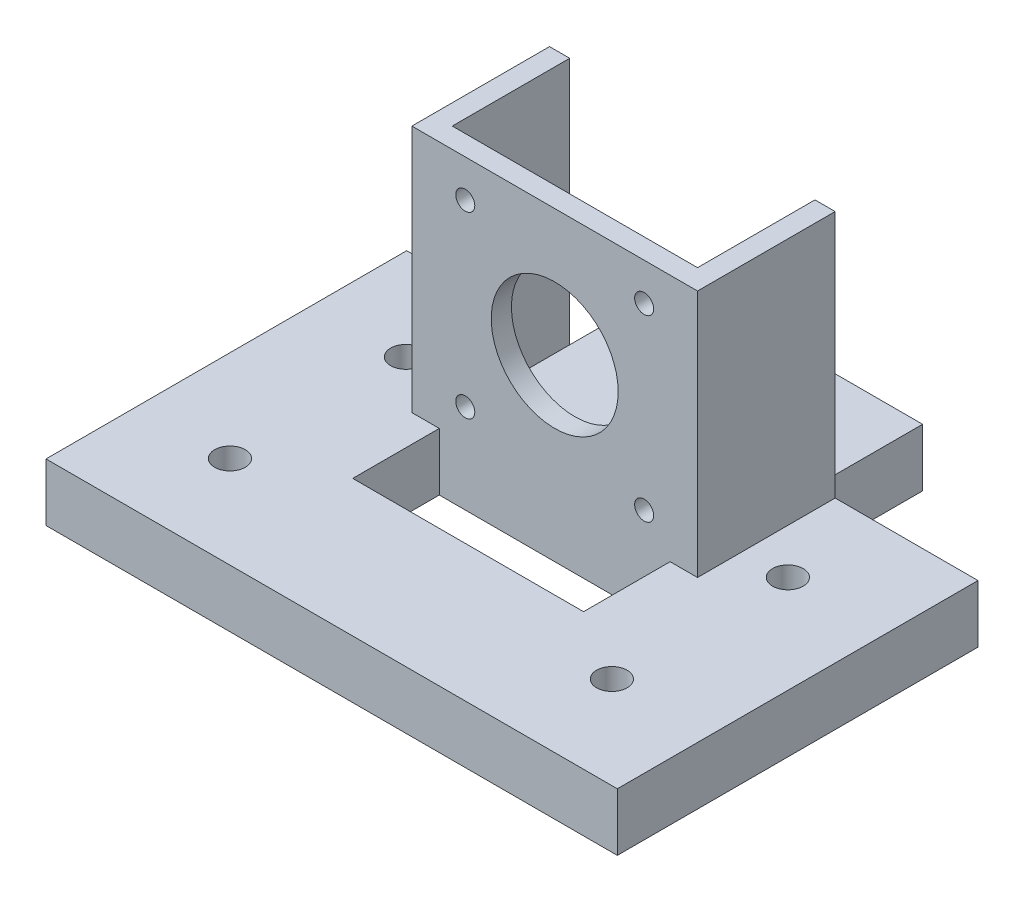
from build123d import *

# Parameters (mm, degrees)
SKETCH1_R           = 2.65
SKETCH1_W           = 40
SKETCH1_H           = 15
BOSS_EXTRUDE1_DEPTH = 10
CUT_EXTRUDE2_DEPTH  = 10
BOSS_EXTRUDE3_DEPTH = 43
CUT_EXTRUDE3_REACH  = 143.262
SKETCH13_R          = 11
SKETCH13_R_2        = 1.65
SKETCH15_W          = 3.5
SKETCH15_H          = 23.85
BOSS_EXTRUDE4_DEPTH = 43
SKETCH16_W          = 42.5
SKETCH16_H          = 3.5
BOSS_EXTRUDE5_DEPTH = 10


with BuildPart() as part:
    # Sketch1 → Boss-Extrude1 (new body)
    with BuildSketch(Plane(origin=(0, 0, 0), x_dir=(1, 0, 0), z_dir=(0, 1, 0))):
        Polygon((51, 85.65), (48, 85.65), (48, 62.5), (26, 62.5), (26, 0), (125, 0), (125, 62.5), (103, 62.5), (103, 85.65), (100, 85.65), align=None)
        with Locations(Location((108.05464, 46.5, 0), (0, 0, 270))):
            Circle(SKETCH1_R, mode=Mode.SUBTRACT)
        with Locations(Location((41.87366, 46.5, 0), (0, 0, 270))):
            Circle(SKETCH1_R, mode=Mode.SUBTRACT)
        with Locations(Location((41.87366, 16, 0), (0, 0, 270))):
            Circle(SKETCH1_R, mode=Mode.SUBTRACT)
        with Locations(Location((108.05464, 16, 0), (0, 0, 270))):
            Circle(SKETCH1_R, mode=Mode.SUBTRACT)
        with Locations((75.5, 31.15)):
            Rectangle(SKETCH1_W, SKETCH1_H, mode=Mode.SUBTRACT)
    extrude(amount=BOSS_EXTRUDE1_DEPTH)

    # Sketch8 → Cut-Extrude2 (cut)
    with BuildSketch(Plane(origin=(0, 10, 0), x_dir=(1, 0, 0), z_dir=(0, 1, 0))):
        Polygon((96.75, 70.488685564), (96.75, 62.5), (103, 62.5), (103, 85.65), (48, 85.65), (48, 62.5), (54.25, 62.5), (54.25, 70.488685564), (54.25, 77.65), (76, 77.65), (96.75, 77.65), align=None)
    extrude(amount=-CUT_EXTRUDE2_DEPTH, mode=Mode.SUBTRACT)

    # Sketch12 → Boss-Extrude3 (add)
    with BuildSketch(Plane(origin=(0, 10, 0), x_dir=(1, 0, 0), z_dir=(0, 1, 0))):
        Polygon((96.75, 42.15), (54.25, 42.15), (54.25, 38.65), (55.5, 38.65), (95.5, 38.65), (96.75, 38.65), align=None)
    extrude(amount=BOSS_EXTRUDE3_DEPTH)

    # Sketch13 → Cut-Extrude3 (cut, up to next)
    with BuildSketch(Plane.XY.offset(-38.65), mode=Mode.PRIVATE) as cut_extrude3_sk1:
        with Locations((75.5, 31)):
            Circle(SKETCH13_R)
    cut_extrude3_tool1 = extrude(cut_extrude3_sk1.sketch, amount=-CUT_EXTRUDE3_REACH, mode=Mode.PRIVATE) & part.part
    # Sketch13 → Cut-Extrude3 (cut, up to next)
    with BuildSketch(Plane.XY.offset(-38.65), mode=Mode.PRIVATE) as cut_extrude3_sk2:
        with Locations((60, 46.5)):
            Circle(SKETCH13_R_2)
    cut_extrude3_tool2 = extrude(cut_extrude3_sk2.sketch, amount=-CUT_EXTRUDE3_REACH, mode=Mode.PRIVATE) & part.part
    # Sketch13 → Cut-Extrude3 (cut, up to next)
    with BuildSketch(Plane.XY.offset(-38.65), mode=Mode.PRIVATE) as cut_extrude3_sk3:
        with Locations((91, 46.5)):
            Circle(SKETCH13_R_2)
    cut_extrude3_tool3 = extrude(cut_extrude3_sk3.sketch, amount=-CUT_EXTRUDE3_REACH, mode=Mode.PRIVATE) & part.part
    # Sketch13 → Cut-Extrude3 (cut, up to next)
    with BuildSketch(Plane.XY.offset(-38.65), mode=Mode.PRIVATE) as cut_extrude3_sk4:
        with Locations((91, 15.5)):
            Circle(SKETCH13_R_2)
    cut_extrude3_tool4 = extrude(cut_extrude3_sk4.sketch, amount=-CUT_EXTRUDE3_REACH, mode=Mode.PRIVATE) & part.part
    # Sketch13 → Cut-Extrude3 (cut, up to next)
    with BuildSketch(Plane.XY.offset(-38.65), mode=Mode.PRIVATE) as cut_extrude3_sk5:
        with Locations((60, 15.5)):
            Circle(SKETCH13_R_2)
    cut_extrude3_tool5 = extrude(cut_extrude3_sk5.sketch, amount=-CUT_EXTRUDE3_REACH, mode=Mode.PRIVATE) & part.part
    add(cut_extrude3_tool1.solids().sort_by_distance((75.5, 31, -38.65))[0], mode=Mode.SUBTRACT)
    add(cut_extrude3_tool2.solids().sort_by_distance((60, 46.5, -38.65))[0], mode=Mode.SUBTRACT)
    add(cut_extrude3_tool3.solids().sort_by_distance((91, 46.5, -38.65))[0], mode=Mode.SUBTRACT)
    add(cut_extrude3_tool4.solids().sort_by_distance((91, 15.5, -38.65))[0], mode=Mode.SUBTRACT)
    add(cut_extrude3_tool5.solids().sort_by_distance((60, 15.5, -38.65))[0], mode=Mode.SUBTRACT)

    # Sketch15 → Boss-Extrude4 (add)
    with BuildSketch(Plane(origin=(0, 10, 0), x_dir=(1, 0, 0), z_dir=(0, 1, 0))):
        with Locations((98.5, 50.575)):
            Rectangle(SKETCH15_W, SKETCH15_H)
        with Locations((52.5, 50.575)):
            Rectangle(SKETCH15_W, SKETCH15_H)
    extrude(amount=BOSS_EXTRUDE4_DEPTH)

    # Sketch16 → Boss-Extrude5 (add)
    with BuildSketch(Plane(origin=(0, 10, 0), x_dir=(1, 0, 0), z_dir=(0, 1, 0))):
        with Locations((75.5, 79.4)):
            Rectangle(SKETCH16_W, SKETCH16_H)
    extrude(amount=-BOSS_EXTRUDE5_DEPTH)


solid = part.part
